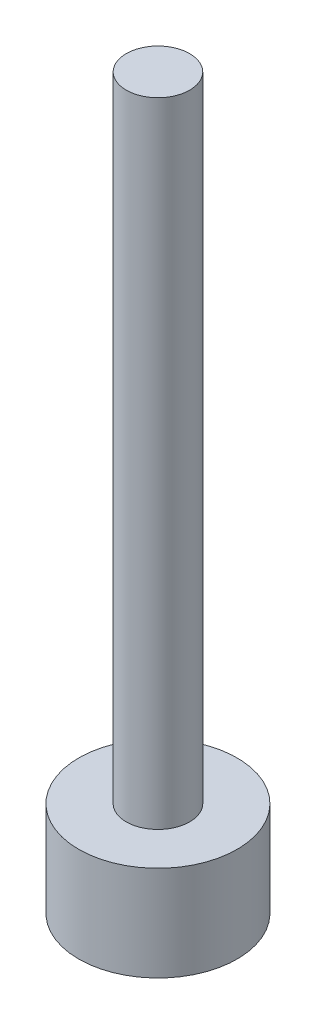
from build123d import *

# Parameters (mm, degrees)
SKETCH2_R           = 2.5
BOSS_EXTRUDE1_DEPTH = 3
SKETCH3_R           = 1
BOSS_EXTRUDE2_DEPTH = 20


with BuildPart() as part:
    # Sketch2 → Boss-Extrude1 (new body)
    with BuildSketch(Plane(origin=(0, 0, 0), x_dir=(1, 0, 0), z_dir=(0, 1, 0))):
        with Locations(Location((0, 0, 0), (0, 0, 270))):
            Circle(SKETCH2_R)
    extrude(amount=BOSS_EXTRUDE1_DEPTH)

    # Sketch3 → Boss-Extrude2 (add)
    with BuildSketch(Plane(origin=(0, 3, 0), x_dir=(1, 0, 0), z_dir=(0, 1, 0))):
        with Locations(Location((0, 0, 0), (0, 0, 270))):
            Circle(SKETCH3_R)
    extrude(amount=BOSS_EXTRUDE2_DEPTH)


solid = part.part
